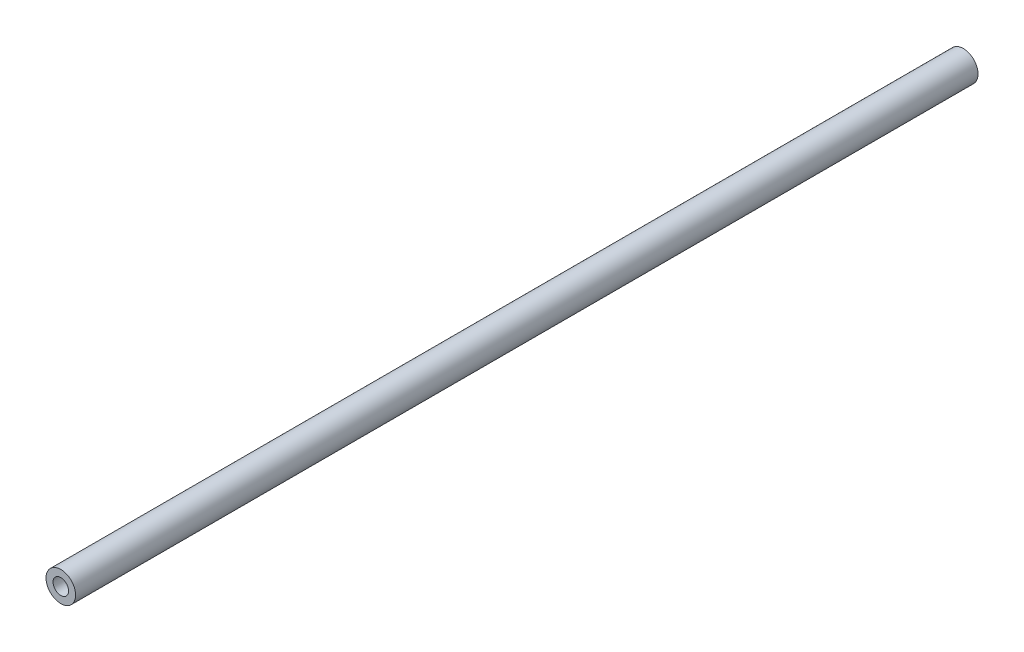
from build123d import *

# Parameters (mm, degrees)
SKETCH_1_R      = 4
EXTRUDE_1_DEPTH = 121.95
SKETCH_3_W      = 2.1
SKETCH_3_H      = 243.9


with BuildPart() as part:
    # 草图1 → 凸台-拉伸1 (new, symmetric)
    with BuildSketch(Plane.XY):
        with Locations(Location((0, 0, 0), (0, 0, 180))):
            Circle(SKETCH_1_R)
    extrude(amount=EXTRUDE_1_DEPTH, both=True)

    # 草图3 → M5 螺纹孔的螺纹孔钻头1 (revolve, cut)
    with BuildSketch(Plane(origin=(0, 0, 121.95), x_dir=(0, -1, 0), z_dir=(1, 0, 0))):
        with Locations((1.05, 121.95)):
            Rectangle(SKETCH_3_W, SKETCH_3_H)
    revolve(axis=Axis((0, 0, 128.3), (0, 0, -1)), mode=Mode.SUBTRACT)


solid = part.part
